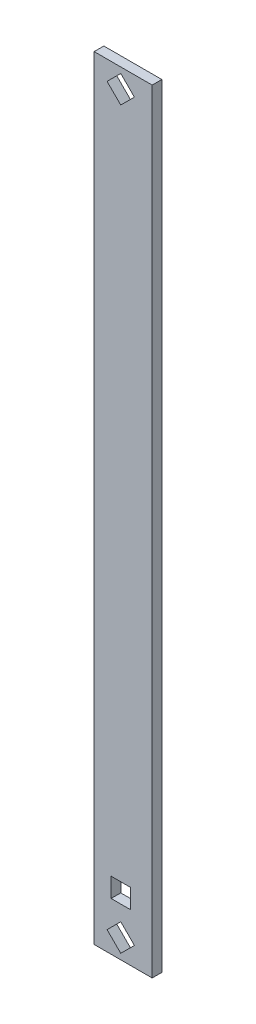
from build123d import *

# Parameters (mm, degrees)
PROFILE_SKETCH_W                  = 6
PROFILE_SKETCH_H                  = 1
PROFILE_EXTRUDE_DEPTH             = 80
FIDUCIAL_CUT_DEPTH                = 82.758091516
FIDUCIAL_1_INDICATOR_SKETCH_W     = 2
FIDUCIAL_1_INDICATOR_SKETCH_H     = 2
INDICATOR_OF_FIDUCIAL_1_CUT_DEPTH = 82.758091516


with BuildPart() as part:
    # Profile Sketch → Profile Extrude (new body)
    with BuildSketch(Plane(origin=(-13.83405858, 0, -105.75669297), x_dir=(-1, 0, 0), z_dir=(0, 1, 0))):
        with Locations((0, 0.5)):
            Rectangle(PROFILE_SKETCH_W, PROFILE_SKETCH_H)
    extrude(amount=PROFILE_EXTRUDE_DEPTH)

    # Fiducial Sketch → Fiducial Cut (cut, through all)
    with BuildSketch(Plane.XY.offset(-104.75669297)):
        Polygon((-12.669845017, 2), (-14.08405858, 3.414213562), (-15.498272142, 2), (-14.08405858, 0.585786438), align=None)
    fiducial_cut = extrude(amount=-FIDUCIAL_CUT_DEPTH, mode=Mode.SUBTRACT)

    # Fiducial Mirror: Fiducial Cut across plane
    add(fiducial_cut.mirror(Plane(origin=(0, 40, 0), x_dir=(0, 0, 1), z_dir=(0, -1, 0))), mode=Mode.SUBTRACT)

    # Fiducial 1 Indicator Sketch → Indicator of Fiducial 1 Cut (cut, through all)
    with BuildSketch(Plane.XY.offset(-104.75669297)):
        with Locations((-14.08405858, 6)):
            Rectangle(FIDUCIAL_1_INDICATOR_SKETCH_W, FIDUCIAL_1_INDICATOR_SKETCH_H)
    extrude(amount=-INDICATOR_OF_FIDUCIAL_1_CUT_DEPTH, mode=Mode.SUBTRACT)


solid = part.part
